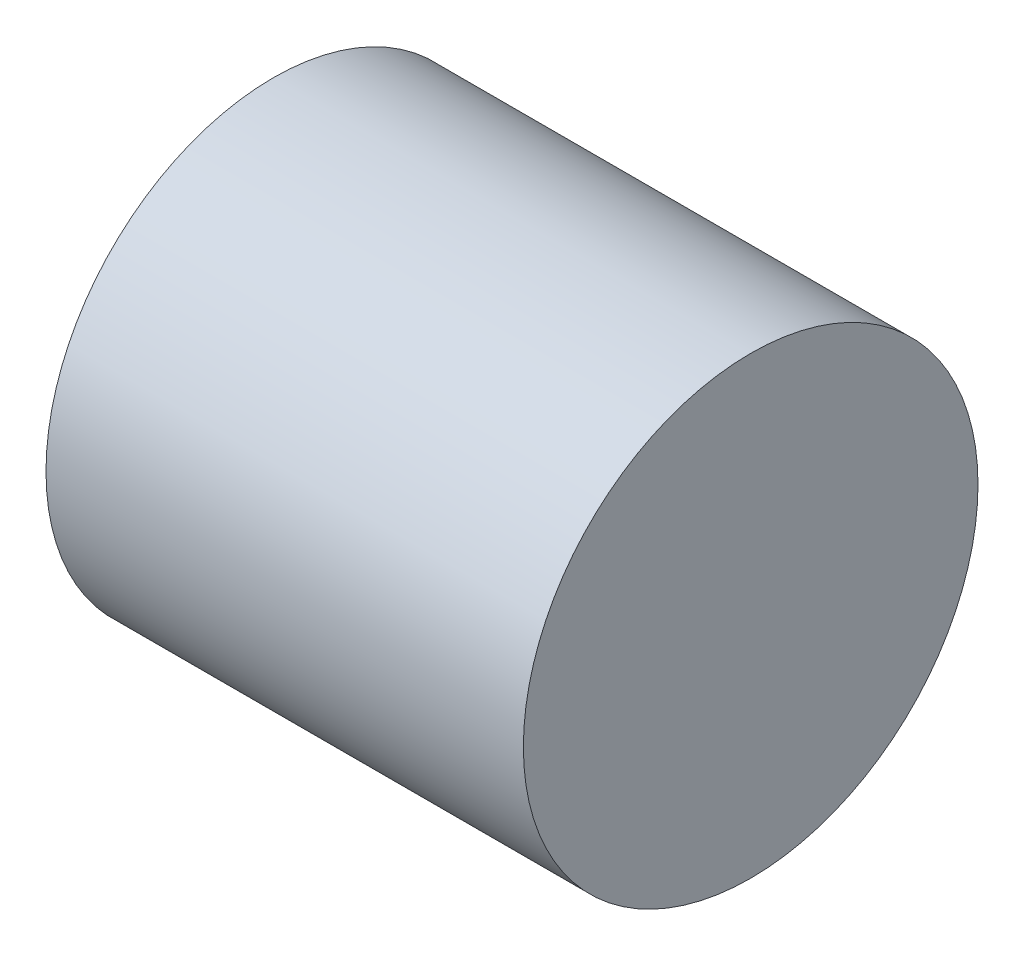
from build123d import *

# Parameters (mm, degrees)
SKETCH1_R           = 8
BOSS_EXTRUDE1_DEPTH = 16.8


with BuildPart() as part:
    # Sketch1 → Boss-Extrude1 (new body)
    with BuildSketch(Plane(origin=(0, 0, 0), x_dir=(0, 0, -1), z_dir=(1, 0, 0))):
        Circle(SKETCH1_R)
    extrude(amount=BOSS_EXTRUDE1_DEPTH)


solid = part.part
